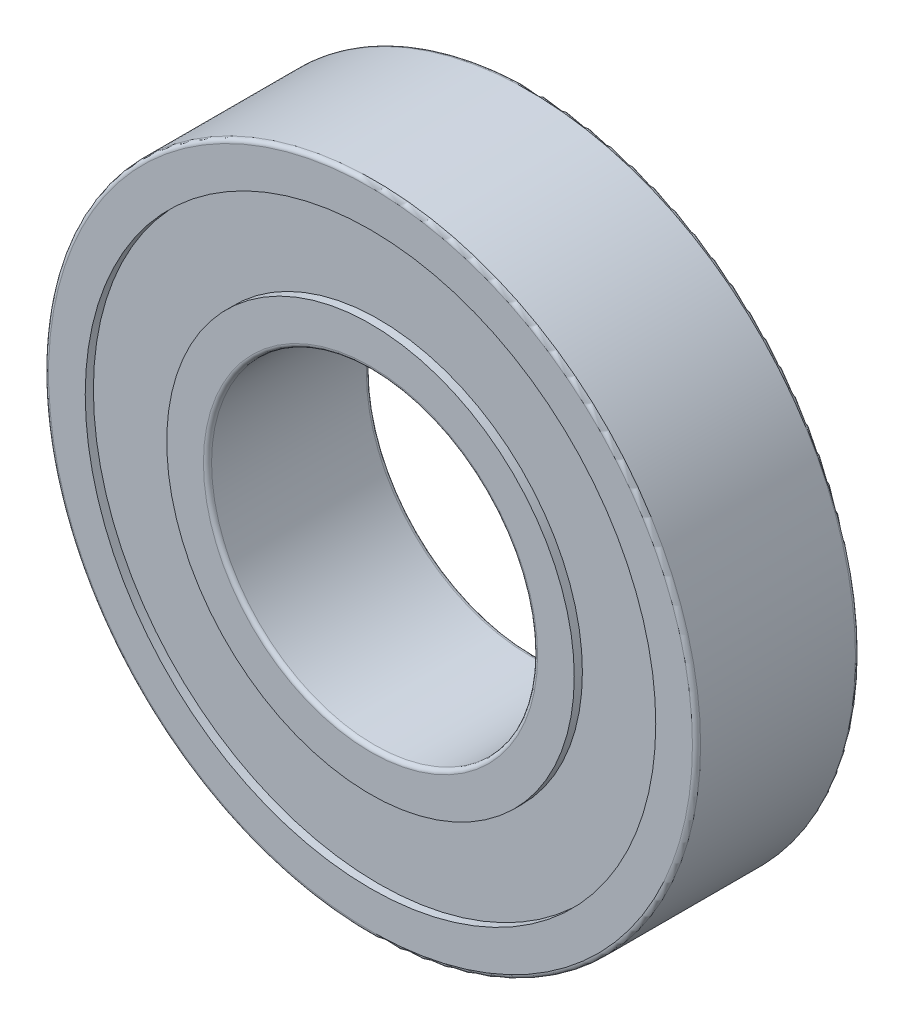
from build123d import *

# Parameters (mm, degrees)
SKETCH1_R           = 12
SKETCH1_R_2         = 6
BOSS_EXTRUDE1_DEPTH = 6
SKETCH2_R           = 10.5
SKETCH2_R_2         = 7.5
CUT_EXTRUDE1_DEPTH  = 0.3
CUT_EXTRUDE2_START  = -5.5
SKETCH2_2_R         = 10.5
SKETCH2_2_R_2       = 7.5
CUT_EXTRUDE2_DEPTH  = 0.5
FILLET1_R           = 0.15


with BuildPart() as part:
    # Sketch1 → Boss-Extrude1 (new body)
    with BuildSketch(Plane.XY):
        Circle(SKETCH1_R)
        Circle(SKETCH1_R_2, mode=Mode.SUBTRACT)
    extrude(amount=BOSS_EXTRUDE1_DEPTH)

    # Sketch2 → Cut-Extrude1 (cut)
    with BuildSketch(Plane.XY.offset(6)):
        Circle(SKETCH2_R)
        Circle(SKETCH2_R_2, mode=Mode.SUBTRACT)
    extrude(amount=-CUT_EXTRUDE1_DEPTH, mode=Mode.SUBTRACT)

    # Sketch2<2> → Cut-Extrude2 (cut)
    with BuildSketch(Plane.XY.offset(6).offset(CUT_EXTRUDE2_START)):
        Circle(SKETCH2_2_R)
        Circle(SKETCH2_2_R_2, mode=Mode.SUBTRACT)
    extrude(amount=-CUT_EXTRUDE2_DEPTH, mode=Mode.SUBTRACT)

    # Fillet1
    fillet1_edges = [part.edges().sort_by_distance(p)[0] for p in [
        (-12, 0, 0),
        (-12, 0, 6),
        (-6, 0, 0),
        (-6, 0, 6),
    ]]
    fillet(fillet1_edges, radius=FILLET1_R)


solid = part.part
